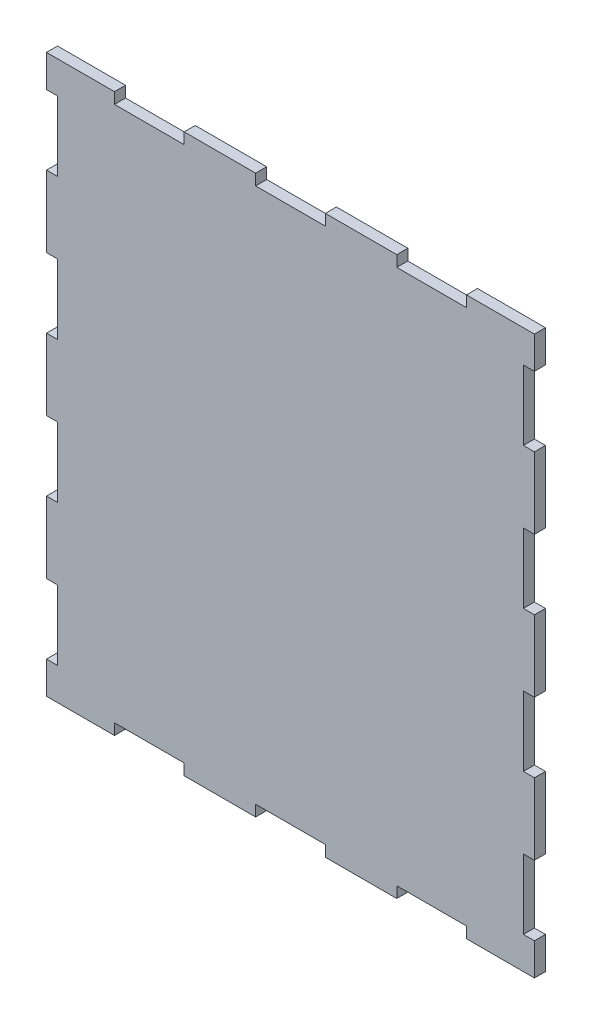
from build123d import *

# Parameters (mm, degrees)
SKETCH1_W           = 140
SKETCH1_H           = 160
BOSS_EXTRUDE2_DEPTH = 3.175
CUT_EXTRUDE1_REACH  = 156.451
SKETCH3_W           = 3.175
SKETCH3_H           = 20
SKETCH3_W_2         = 20
SKETCH3_H_2         = 3.175


with BuildPart() as part:
    # Sketch1 → Boss-Extrude2 (new body)
    with BuildSketch(Plane.XY):
        with Locations((-5.981871877, 54.431521206)):
            Rectangle(SKETCH1_W, SKETCH1_H)
    extrude(amount=BOSS_EXTRUDE2_DEPTH)

    # Sketch3 → Cut-Extrude1 (cut, up to next)
    with BuildSketch(Plane.XY.offset(3.175), mode=Mode.PRIVATE) as cut_extrude1_sk1:
        with Locations((-74.394371877, -6.318478794)):
            Rectangle(SKETCH3_W, SKETCH3_H)
    cut_extrude1_tool1 = extrude(cut_extrude1_sk1.sketch, amount=-CUT_EXTRUDE1_REACH, mode=Mode.PRIVATE) & part.part
    # Sketch3 → Cut-Extrude1 (cut, up to next)
    with BuildSketch(Plane.XY.offset(3.175), mode=Mode.PRIVATE) as cut_extrude1_sk2:
        with Locations((-74.394371877, 34.181521206)):
            Rectangle(SKETCH3_W, SKETCH3_H)
    cut_extrude1_tool2 = extrude(cut_extrude1_sk2.sketch, amount=-CUT_EXTRUDE1_REACH, mode=Mode.PRIVATE) & part.part
    # Sketch3 → Cut-Extrude1 (cut, up to next)
    with BuildSketch(Plane.XY.offset(3.175), mode=Mode.PRIVATE) as cut_extrude1_sk3:
        with Locations((-74.394371877, 74.681521206)):
            Rectangle(SKETCH3_W, SKETCH3_H)
    cut_extrude1_tool3 = extrude(cut_extrude1_sk3.sketch, amount=-CUT_EXTRUDE1_REACH, mode=Mode.PRIVATE) & part.part
    # Sketch3 → Cut-Extrude1 (cut, up to next)
    with BuildSketch(Plane.XY.offset(3.175), mode=Mode.PRIVATE) as cut_extrude1_sk4:
        with Locations((-74.394371877, 115.181521206)):
            Rectangle(SKETCH3_W, SKETCH3_H)
    cut_extrude1_tool4 = extrude(cut_extrude1_sk4.sketch, amount=-CUT_EXTRUDE1_REACH, mode=Mode.PRIVATE) & part.part
    # Sketch3 → Cut-Extrude1 (cut, up to next)
    with BuildSketch(Plane.XY.offset(3.175), mode=Mode.PRIVATE) as cut_extrude1_sk5:
        with Locations((-5.981871877, -23.980978794)):
            Rectangle(SKETCH3_W_2, SKETCH3_H_2)
    cut_extrude1_tool5 = extrude(cut_extrude1_sk5.sketch, amount=-CUT_EXTRUDE1_REACH, mode=Mode.PRIVATE) & part.part
    # Sketch3 → Cut-Extrude1 (cut, up to next)
    with BuildSketch(Plane.XY.offset(3.175), mode=Mode.PRIVATE) as cut_extrude1_sk6:
        with Locations((-46.481871877, -23.980978794)):
            Rectangle(SKETCH3_W_2, SKETCH3_H_2)
    cut_extrude1_tool6 = extrude(cut_extrude1_sk6.sketch, amount=-CUT_EXTRUDE1_REACH, mode=Mode.PRIVATE) & part.part
    # Sketch3 → Cut-Extrude1 (cut, up to next)
    with BuildSketch(Plane.XY.offset(3.175), mode=Mode.PRIVATE) as cut_extrude1_sk7:
        with Locations((34.518128123, -23.980978794)):
            Rectangle(SKETCH3_W_2, SKETCH3_H_2)
    cut_extrude1_tool7 = extrude(cut_extrude1_sk7.sketch, amount=-CUT_EXTRUDE1_REACH, mode=Mode.PRIVATE) & part.part
    # Sketch3 → Cut-Extrude1 (cut, up to next)
    with BuildSketch(Plane.XY.offset(3.175), mode=Mode.PRIVATE) as cut_extrude1_sk8:
        with Locations((-46.481871877, 132.844021206)):
            Rectangle(SKETCH3_W_2, SKETCH3_H_2)
    cut_extrude1_tool8 = extrude(cut_extrude1_sk8.sketch, amount=-CUT_EXTRUDE1_REACH, mode=Mode.PRIVATE) & part.part
    # Sketch3 → Cut-Extrude1 (cut, up to next)
    with BuildSketch(Plane.XY.offset(3.175), mode=Mode.PRIVATE) as cut_extrude1_sk9:
        with Locations((-5.981871877, 132.844021206)):
            Rectangle(SKETCH3_W_2, SKETCH3_H_2)
    cut_extrude1_tool9 = extrude(cut_extrude1_sk9.sketch, amount=-CUT_EXTRUDE1_REACH, mode=Mode.PRIVATE) & part.part
    # Sketch3 → Cut-Extrude1 (cut, up to next)
    with BuildSketch(Plane.XY.offset(3.175), mode=Mode.PRIVATE) as cut_extrude1_sk10:
        with Locations((34.518128123, 132.844021206)):
            Rectangle(SKETCH3_W_2, SKETCH3_H_2)
    cut_extrude1_tool10 = extrude(cut_extrude1_sk10.sketch, amount=-CUT_EXTRUDE1_REACH, mode=Mode.PRIVATE) & part.part
    # Sketch3 → Cut-Extrude1 (cut, up to next)
    with BuildSketch(Plane.XY.offset(3.175), mode=Mode.PRIVATE) as cut_extrude1_sk11:
        with Locations((62.430628123, 115.181521206)):
            Rectangle(SKETCH3_W, SKETCH3_H)
    cut_extrude1_tool11 = extrude(cut_extrude1_sk11.sketch, amount=-CUT_EXTRUDE1_REACH, mode=Mode.PRIVATE) & part.part
    # Sketch3 → Cut-Extrude1 (cut, up to next)
    with BuildSketch(Plane.XY.offset(3.175), mode=Mode.PRIVATE) as cut_extrude1_sk12:
        with Locations((62.430628123, 74.681521206)):
            Rectangle(SKETCH3_W, SKETCH3_H)
    cut_extrude1_tool12 = extrude(cut_extrude1_sk12.sketch, amount=-CUT_EXTRUDE1_REACH, mode=Mode.PRIVATE) & part.part
    # Sketch3 → Cut-Extrude1 (cut, up to next)
    with BuildSketch(Plane.XY.offset(3.175), mode=Mode.PRIVATE) as cut_extrude1_sk13:
        with Locations((62.430628123, 34.181521206)):
            Rectangle(SKETCH3_W, SKETCH3_H)
    cut_extrude1_tool13 = extrude(cut_extrude1_sk13.sketch, amount=-CUT_EXTRUDE1_REACH, mode=Mode.PRIVATE) & part.part
    # Sketch3 → Cut-Extrude1 (cut, up to next)
    with BuildSketch(Plane.XY.offset(3.175), mode=Mode.PRIVATE) as cut_extrude1_sk14:
        with Locations((62.430628123, -6.318478794)):
            Rectangle(SKETCH3_W, SKETCH3_H)
    cut_extrude1_tool14 = extrude(cut_extrude1_sk14.sketch, amount=-CUT_EXTRUDE1_REACH, mode=Mode.PRIVATE) & part.part
    add(cut_extrude1_tool1.solids().sort_by_distance((-74.394372, -6.318479, 3.175))[0], mode=Mode.SUBTRACT)
    add(cut_extrude1_tool2.solids().sort_by_distance((-74.394372, 34.181521, 3.175))[0], mode=Mode.SUBTRACT)
    add(cut_extrude1_tool3.solids().sort_by_distance((-74.394372, 74.681521, 3.175))[0], mode=Mode.SUBTRACT)
    add(cut_extrude1_tool4.solids().sort_by_distance((-74.394372, 115.181521, 3.175))[0], mode=Mode.SUBTRACT)
    add(cut_extrude1_tool5.solids().sort_by_distance((-5.981872, -23.980979, 3.175))[0], mode=Mode.SUBTRACT)
    add(cut_extrude1_tool6.solids().sort_by_distance((-46.481872, -23.980979, 3.175))[0], mode=Mode.SUBTRACT)
    add(cut_extrude1_tool7.solids().sort_by_distance((34.518128, -23.980979, 3.175))[0], mode=Mode.SUBTRACT)
    add(cut_extrude1_tool8.solids().sort_by_distance((-46.481872, 132.844021, 3.175))[0], mode=Mode.SUBTRACT)
    add(cut_extrude1_tool9.solids().sort_by_distance((-5.981872, 132.844021, 3.175))[0], mode=Mode.SUBTRACT)
    add(cut_extrude1_tool10.solids().sort_by_distance((34.518128, 132.844021, 3.175))[0], mode=Mode.SUBTRACT)
    add(cut_extrude1_tool11.solids().sort_by_distance((62.430628, 115.181521, 3.175))[0], mode=Mode.SUBTRACT)
    add(cut_extrude1_tool12.solids().sort_by_distance((62.430628, 74.681521, 3.175))[0], mode=Mode.SUBTRACT)
    add(cut_extrude1_tool13.solids().sort_by_distance((62.430628, 34.181521, 3.175))[0], mode=Mode.SUBTRACT)
    add(cut_extrude1_tool14.solids().sort_by_distance((62.430628, -6.318479, 3.175))[0], mode=Mode.SUBTRACT)


solid = part.part
